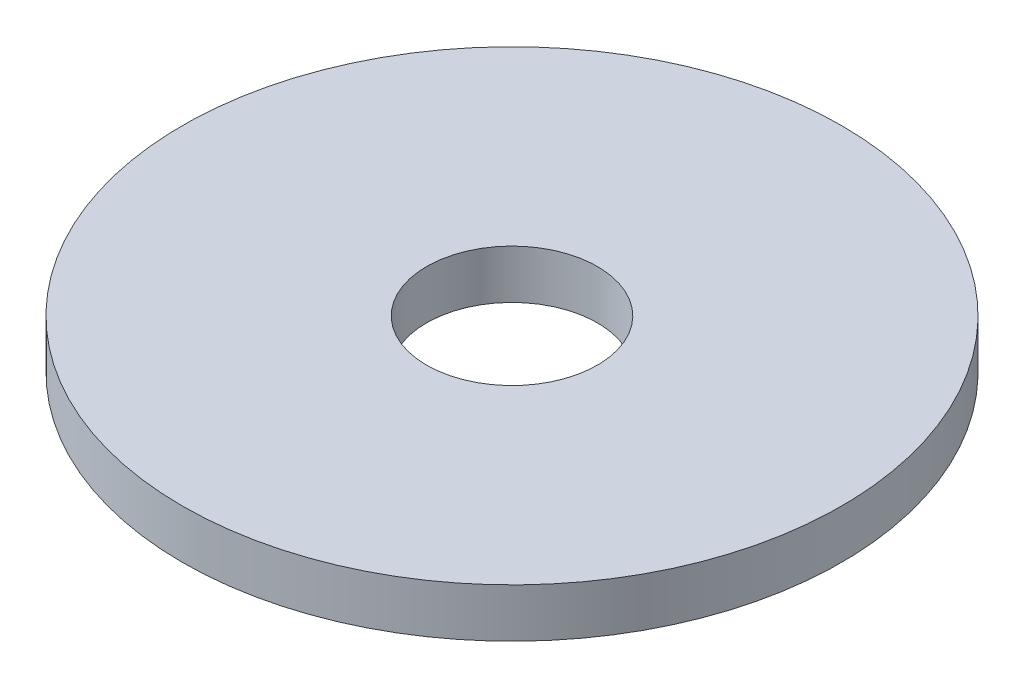
from build123d import *

# Parameters (mm, degrees)
SKETCH1_R           = 6.75
SKETCH1_R_2         = 1.75
BOSS_EXTRUDE1_DEPTH = 1


with BuildPart() as part:
    # Sketch1 → Boss-Extrude1 (new body)
    with BuildSketch(Plane(origin=(0, 0, 0), x_dir=(1, 0, 0), z_dir=(0, 1, 0))):
        with Locations(Location((0, 0, 0), (0, 0, 270))):
            Circle(SKETCH1_R)
        with Locations(Location((0, 0, 0), (0, 0, 270))):
            Circle(SKETCH1_R_2, mode=Mode.SUBTRACT)
    extrude(amount=BOSS_EXTRUDE1_DEPTH)


solid = part.part
